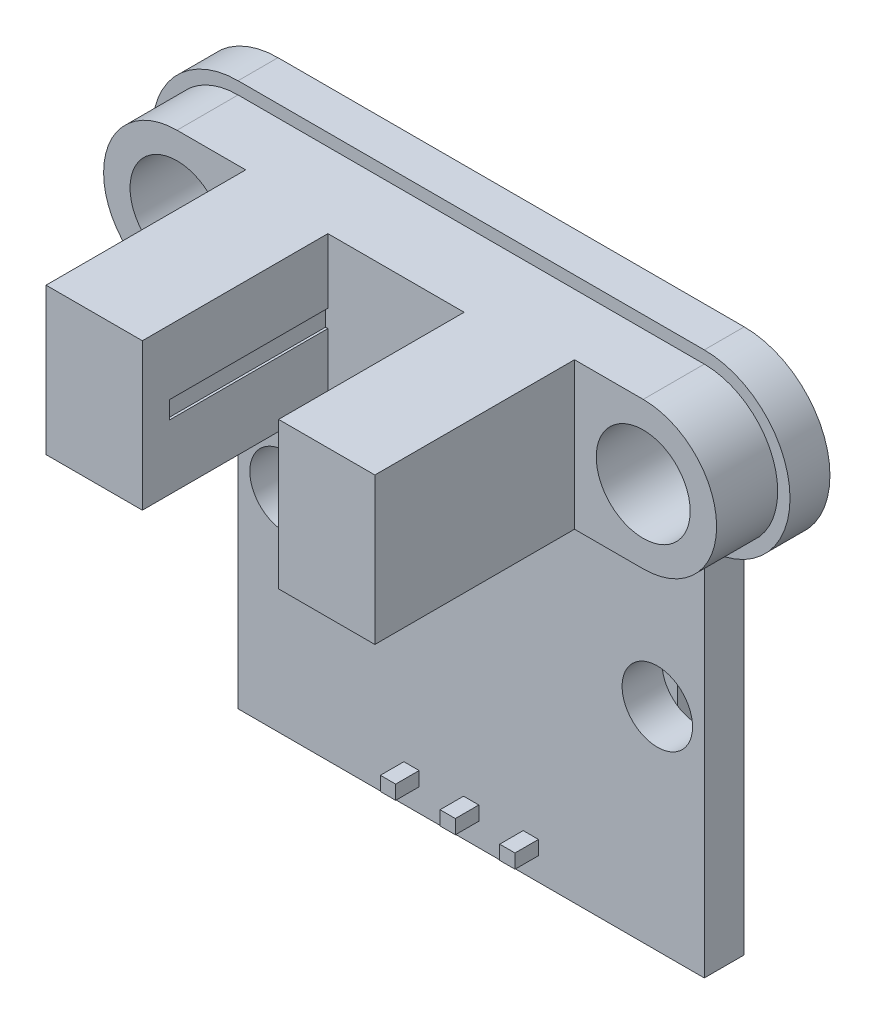
from build123d import *

# Parameters (mm, degrees)
IZIM1_R                     = 2
IZIM1_R_2                   = 1.5
Y_KSEKLIK_EKSTR_ZYON1_DEPTH = 1.7
IZIM2_R                     = 2
Y_KSEKLIK_EKSTR_ZYON2_DEPTH = 2.6
IZIM3_W                     = 4.100055298
IZIM3_H                     = 6.25
Y_KSEKLIK_EKSTR_ZYON3_DEPTH = 8.5
IZIM4_W                     = 5.8
IZIM4_H                     = 6.25
Y_KSEKLIK_EKSTR_ZYON4_DEPTH = 0.6
Y_KSEKLIK_EKSTR_ZYON6_DEPTH = 2.54
IZIM6_W                     = 19.85
IZIM6_H                     = 1.7
Y_KSEKLIK_EKSTR_ZYON7_DEPTH = 0.01
KES_EKSTR_ZYON1_DEPTH       = 5.9
KES_EKSTR_ZYON1_DEPTH_BACK  = 0.1
IZIM7_W                     = 6.75
IZIM7_H                     = 0.75
IZIM8_W                     = 0.664910116
IZIM8_H                     = 0.664910116
IZIM11_W                    = 0.65
IZIM11_H                    = 0.6
Y_KSEKLIK_EKSTR_ZYON8_DEPTH = 1
Y_KSEKLIK_EKSTR_ZYON9_DEPTH = 1.5


with BuildPart() as part:
    # Çizim1 → Yükseklik-Ekstrüzyon1 (new body)
    with BuildSketch(Plane.XY):
        with BuildLine():
            Line((-9.925, -11.575), (9.925, -11.575))
            Line((9.925, -11.575), (9.925, 4.275))
            ThreePointArc((9.925, 4.275), (13.575, 7.925), (9.925, 11.575))
            Line((9.925, 11.575), (-9.925, 11.575))
            ThreePointArc((-9.925, 11.575), (-13.575, 7.925), (-9.925, 4.275))
            Line((-9.925, 4.275), (-9.925, -11.575))
        make_face()
        with Locations((9.925, 7.925)):
            Circle(IZIM1_R, mode=Mode.SUBTRACT)
        with Locations(Location((-9.925, 7.925, 0), (0, 0, 180))):
            Circle(IZIM1_R, mode=Mode.SUBTRACT)
        with Locations((7.925, -2.575)):
            Circle(IZIM1_R_2, mode=Mode.SUBTRACT)
        with Locations(Location((-7.925, -2.575, 0), (0, 0, 180))):
            Circle(IZIM1_R_2, mode=Mode.SUBTRACT)
    extrude(amount=Y_KSEKLIK_EKSTR_ZYON1_DEPTH)

    # Çizim2 → Yükseklik-Ekstrüzyon2 (add)
    with BuildSketch(Plane.XY.offset(1.7)):
        with BuildLine():
            Line((-9.925, 11.05), (9.925, 11.05))
            ThreePointArc((9.925, 11.05), (13.05, 7.925), (9.925, 4.8))
            Line((9.925, 4.8), (-9.925, 4.8))
            ThreePointArc((-9.925, 4.8), (-13.05, 7.925), (-9.925, 11.05))
        make_face()
        with Locations(Location((-9.925, 7.925, 0), (0, 0, 180))):
            Circle(IZIM2_R, mode=Mode.SUBTRACT)
        with Locations((9.925, 7.925)):
            Circle(IZIM2_R, mode=Mode.SUBTRACT)
    extrude(amount=Y_KSEKLIK_EKSTR_ZYON2_DEPTH)

    # Çizim3 → Yükseklik-Ekstrüzyon3 (add)
    with BuildSketch(Plane.XY.offset(4.3)):
        with Locations((4.950027649, 7.925)):
            Rectangle(IZIM3_W, IZIM3_H)
        with Locations((-4.950027649, 7.925)):
            Rectangle(IZIM3_W, IZIM3_H)
    extrude(amount=Y_KSEKLIK_EKSTR_ZYON3_DEPTH)

    # Çizim4 → Yükseklik-Ekstrüzyon4 (add)
    with BuildSketch(Plane.XY.offset(4.3)):
        with Locations((0, 7.925)):
            Rectangle(IZIM4_W, IZIM4_H)
    extrude(amount=Y_KSEKLIK_EKSTR_ZYON4_DEPTH)

    # Çizim5 → Yükseklik-Ekstrüzyon6 (add)
    with BuildSketch(Plane(origin=(0, 0, 0), x_dir=(-1, 0, 0), z_dir=(0, 0, -1))):
        Polygon((-1.27, -11.325), (-1.27, -9.285), (-1.52, -9.035), (-3.56, -9.035), (-3.81, -9.285), (-3.81, -11.325), (-3.56, -11.575), (-1.52, -11.575), align=None)
        Polygon((1.27, -9.285), (1.02, -9.035), (-1.02, -9.035), (-1.27, -9.285), (-1.27, -11.325), (-1.02, -11.575), (1.02, -11.575), (1.27, -11.325), align=None)
        Polygon((1.52, -9.035), (1.27, -9.285), (1.27, -11.325), (1.52, -11.575), (3.56, -11.575), (3.81, -11.325), (3.81, -9.285), (3.56, -9.035), align=None)
    extrude(amount=Y_KSEKLIK_EKSTR_ZYON6_DEPTH)

    # Çizim6 → Yükseklik-Ekstrüzyon7 (add)
    with BuildSketch(Plane.XZ.offset(11.575)):
        with Locations((0, 0.85)):
            Rectangle(IZIM6_W, IZIM6_H)
    extrude(amount=Y_KSEKLIK_EKSTR_ZYON7_DEPTH)

    # Çizim7 → Kes-Ekstrüzyon1 (cut, two sides: drawn at the far end of the back side and taken through both)
    with BuildSketch(Plane.ZY.offset(-2.9).offset(-KES_EKSTR_ZYON1_DEPTH_BACK)):
        with Locations((8.275, 7.925)):
            Rectangle(IZIM7_W, IZIM7_H)
    extrude(amount=KES_EKSTR_ZYON1_DEPTH + KES_EKSTR_ZYON1_DEPTH_BACK, mode=Mode.SUBTRACT)

    # Süpür1: sweep along a path in Çizim9
    with BuildLine(Plane(origin=(0, 0, 0), x_dir=(0, 0, -1), z_dir=(1, 0, 0))) as s_p_r1_path:
        Line((2.54, -10.305), (4.04, -10.305))
        ThreePointArc((4.04, -10.305), (4.393553391, -10.158553391), (4.54, -9.805))
        Line((4.54, -9.805), (4.54, -3.305))
    # Çizim8 → Süpür1 (sweep)
    with BuildSketch(Plane(origin=(0, 0, -2.54), x_dir=(-1, 0, 0), z_dir=(0, 0, -1))):
        with Locations((2.54, -10.305)):
            Rectangle(IZIM8_W, IZIM8_H)
        with Locations((0, -10.305)):
            Rectangle(IZIM8_W, IZIM8_H)
        with Locations((-2.54, -10.305)):
            Rectangle(IZIM8_W, IZIM8_H)
    sweep(path=s_p_r1_path.line)

    # Çizim11 → Yükseklik-Ekstrüzyon8 (add)
    with BuildSketch(Plane.XY.offset(1.7)):
        with Locations((-2.54, -10.305)):
            Rectangle(IZIM11_W, IZIM11_H)
        with Locations((0, -10.305)):
            Rectangle(IZIM11_W, IZIM11_H)
        with Locations((2.54, -10.305)):
            Rectangle(IZIM11_W, IZIM11_H)
    extrude(amount=Y_KSEKLIK_EKSTR_ZYON8_DEPTH)

    # Çizim12 → Yükseklik-Ekstrüzyon9 (add)
    with BuildSketch(Plane(origin=(0, 0, 0), x_dir=(-1, 0, 0), z_dir=(0, 0, -1))):
        Polygon((-3.925, -2.575), (-3.925, -0.075), (-0.175, -0.075), (-0.175, -5.075), (-3.925, -5.075), align=None)
    extrude(amount=Y_KSEKLIK_EKSTR_ZYON9_DEPTH)


solid = part.part
